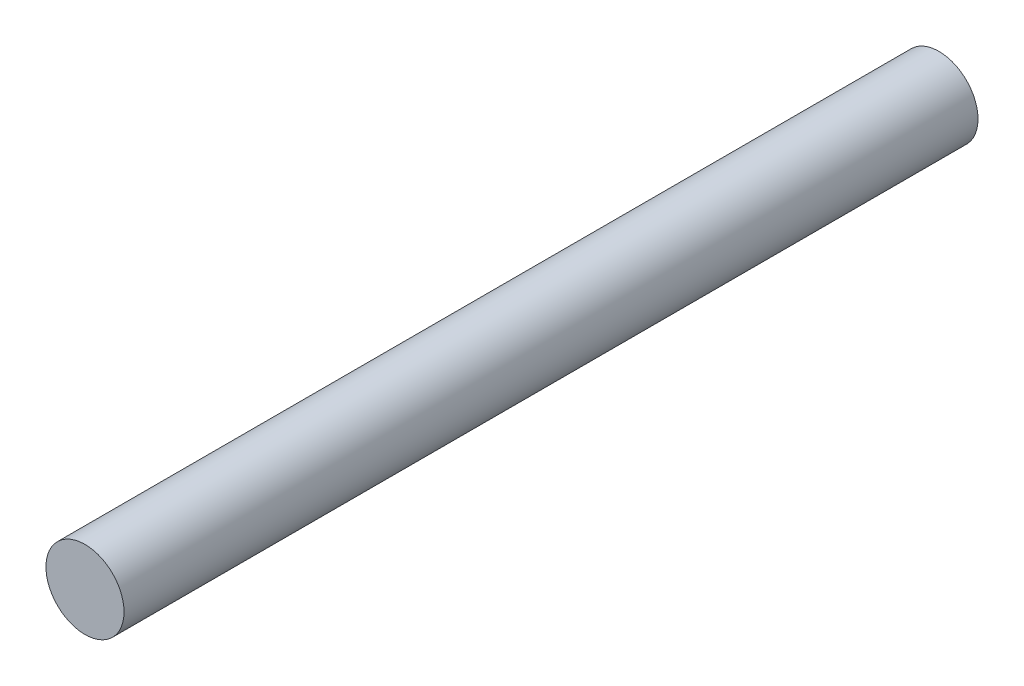
from build123d import *

# Parameters (mm, degrees)
CROQUIS1_R              = 1.5
SALIENTE_EXTRUIR1_DEPTH = 32.8


with BuildPart() as part:
    # Croquis1 → Saliente-Extruir1 (new body)
    with BuildSketch(Plane.XY):
        Circle(CROQUIS1_R)
    extrude(amount=-SALIENTE_EXTRUIR1_DEPTH)


solid = part.part
